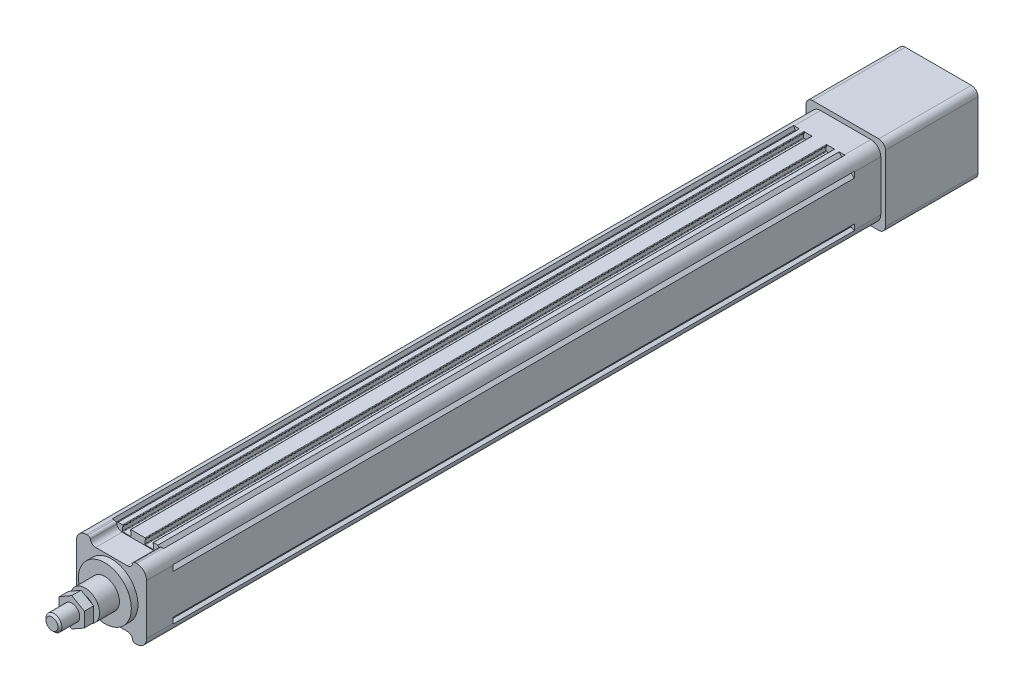
from build123d import *

# Parameters (mm, degrees)
SKETCH_1_R             = 2.1
EXTRUDE_1_DEPTH        = 515
EXTRUDE_2_DEPTH        = 20
SKETCH_7_R             = 20
EXTRUDE_3_DEPTH        = 5
SKETCH_9_R             = 11
EXTRUDE_4_DEPTH        = 15
SKETCH_10_R            = 6
EXTRUDE_5_DEPTH        = 25
EXTRUDE_START          = 20
EXTRUDE_6_DEPTH        = 20
EXTRUDE_7_DEPTH        = 70
SKETCH_14_R            = 19
CUT_EXTRUDE_2_DEPTH    = 70
HOLE_WIZARD_M6_1_D     = 5
HOLE_WIZARD_M6_1_DEPTH = 15
HOLE_WIZARD_M6_1_TIP   = 1.502151548
CHAMFER_1_SIZE         = 1.5
EXTRUDE_START_2        = 3
EXTRUDE_8_DEPTH        = 7


with BuildPart() as part:
    # 草图1 → 凸台-拉伸1 (new body)
    with BuildSketch(Plane.XY):
        with BuildLine():
            Line((-18.2, 24), (-19.443439638, 26.486879276))
            ThreePointArc((-19.443439638, 26.486879276), (-24.303300859, 24.303300859), (-26.486879276, 19.443439638))
            Line((-26.486879276, 19.443439638), (-24, 18.2))
            Line((-24, 18.2), (-24, 17.1))
            Line((-24, 17.1), (-26.5, 15))
            Line((-26.5, 15), (-26.5, -15))
            Line((-26.5, -15), (-24, -17.1))
            Line((-24, -17.1), (-24, -18.2))
            Line((-24, -18.2), (-26.486879276, -19.443439638))
            ThreePointArc((-26.486879276, -19.443439638), (-24.303300859, -24.303300859), (-19.443439638, -26.486879276))
            Line((-19.443439638, -26.486879276), (-18.2, -24))
            Line((-18.2, -24), (-17.1, -24))
            Line((-17.1, -24), (-15, -26.5))
            Line((-15, -26.5), (-11.65, -26.5))
            ThreePointArc((-11.65, -26.5), (-11.367157288, -26.382842712), (-11.25, -26.1))
            Line((-11.25, -26.1), (-11.25, -25.6))
            ThreePointArc((-11.25, -25.6), (-11.367157288, -25.317157288), (-11.65, -25.2))
            Line((-11.65, -25.2), (-11.75, -25.2))
            Line((-11.75, -25.2), (-11.75, -22.4))
            ThreePointArc((-11.75, -22.4), (-11.632842712, -22.117157288), (-11.35, -22))
            Line((-11.35, -22), (-5.65, -22))
            ThreePointArc((-5.65, -22), (-5.367157288, -22.117157288), (-5.25, -22.4))
            Line((-5.25, -22.4), (-5.25, -25.2))
            Line((-5.25, -25.2), (-5.35, -25.2))
            ThreePointArc((-5.35, -25.2), (-5.632842712, -25.317157288), (-5.75, -25.6))
            Line((-5.75, -25.6), (-5.75, -26.1))
            ThreePointArc((-5.75, -26.1), (-5.632842712, -26.382842712), (-5.35, -26.5))
            Line((-5.35, -26.5), (5.35, -26.5))
            ThreePointArc((5.35, -26.5), (5.632842712, -26.382842712), (5.75, -26.1))
            Line((5.75, -26.1), (5.75, -25.6))
            ThreePointArc((5.75, -25.6), (5.632842712, -25.317157288), (5.35, -25.2))
            Line((5.35, -25.2), (5.25, -25.2))
            Line((5.25, -25.2), (5.25, -22.4))
            ThreePointArc((5.25, -22.4), (5.367157288, -22.117157288), (5.65, -22))
            Line((5.65, -22), (11.35, -22))
            ThreePointArc((11.35, -22), (11.632842712, -22.117157288), (11.75, -22.4))
            Line((11.75, -22.4), (11.75, -25.2))
            Line((11.75, -25.2), (11.65, -25.2))
            ThreePointArc((11.65, -25.2), (11.367157288, -25.317157288), (11.25, -25.6))
            Line((11.25, -25.6), (11.25, -26.1))
            ThreePointArc((11.25, -26.1), (11.367157288, -26.382842712), (11.65, -26.5))
            Line((11.65, -26.5), (15, -26.5))
            Line((15, -26.5), (17.1, -24))
            Line((17.1, -24), (18.2, -24))
            Line((18.2, -24), (19.443439638, -26.486879276))
            ThreePointArc((19.443439638, -26.486879276), (24.303300859, -24.303300859), (26.486879276, -19.443439638))
            Line((26.486879276, -19.443439638), (24, -18.2))
            Line((24, -18.2), (24, -17.1))
            Line((24, -17.1), (26.5, -15))
            Line((26.5, -15), (26.5, 15))
            Line((26.5, 15), (24, 17.1))
            Line((24, 17.1), (24, 18.2))
            Line((24, 18.2), (26.486879276, 19.443439638))
            ThreePointArc((26.486879276, 19.443439638), (24.303300859, 24.303300859), (19.443439638, 26.486879276))
            Line((19.443439638, 26.486879276), (18.2, 24))
            Line((18.2, 24), (17.1, 24))
            Line((17.1, 24), (15, 26.5))
            Line((15, 26.5), (11.65, 26.5))
            ThreePointArc((11.65, 26.5), (11.367157288, 26.382842712), (11.25, 26.1))
            Line((11.25, 26.1), (11.25, 25.6))
            ThreePointArc((11.25, 25.6), (11.367157288, 25.317157288), (11.65, 25.2))
            Line((11.65, 25.2), (11.75, 25.2))
            Line((11.75, 25.2), (11.75, 22.4))
            ThreePointArc((11.75, 22.4), (11.632842712, 22.117157288), (11.35, 22))
            Line((11.35, 22), (5.65, 22))
            ThreePointArc((5.65, 22), (5.367157288, 22.117157288), (5.25, 22.4))
            Line((5.25, 22.4), (5.25, 25.2))
            Line((5.25, 25.2), (5.35, 25.2))
            ThreePointArc((5.35, 25.2), (5.632842712, 25.317157288), (5.75, 25.6))
            Line((5.75, 25.6), (5.75, 26.1))
            ThreePointArc((5.75, 26.1), (5.632842712, 26.382842712), (5.35, 26.5))
            Line((5.35, 26.5), (-5.35, 26.5))
            ThreePointArc((-5.35, 26.5), (-5.632842712, 26.382842712), (-5.75, 26.1))
            Line((-5.75, 26.1), (-5.75, 25.6))
            ThreePointArc((-5.75, 25.6), (-5.632842712, 25.317157288), (-5.35, 25.2))
            Line((-5.35, 25.2), (-5.25, 25.2))
            Line((-5.25, 25.2), (-5.25, 22.4))
            ThreePointArc((-5.25, 22.4), (-5.367157288, 22.117157288), (-5.65, 22))
            Line((-5.65, 22), (-11.35, 22))
            ThreePointArc((-11.35, 22), (-11.632842712, 22.117157288), (-11.75, 22.4))
            Line((-11.75, 22.4), (-11.75, 25.2))
            Line((-11.75, 25.2), (-11.65, 25.2))
            ThreePointArc((-11.65, 25.2), (-11.367157288, 25.317157288), (-11.25, 25.6))
            Line((-11.25, 25.6), (-11.25, 26.1))
            ThreePointArc((-11.25, 26.1), (-11.367157288, 26.382842712), (-11.65, 26.5))
            Line((-11.65, 26.5), (-15, 26.5))
            Line((-15, 26.5), (-17.1, 24))
            Line((-17.1, 24), (-18.2, 24))
        make_face()
        with Locations((19, 19)):
            Circle(SKETCH_1_R, mode=Mode.SUBTRACT)
        with Locations((19, -19)):
            Circle(SKETCH_1_R, mode=Mode.SUBTRACT)
        with Locations((-19, -19)):
            Circle(SKETCH_1_R, mode=Mode.SUBTRACT)
        with Locations((-19, 19)):
            Circle(SKETCH_1_R, mode=Mode.SUBTRACT)
        with BuildLine():
            Line((19.773719933, 3), (23.3, 3))
            Line((23.3, 3), (23.3, -3))
            Line((23.3, -3), (19.773719933, -3))
            ThreePointArc((19.773719933, -3), (0, -20), (-19.773719933, -3))
            Line((-19.773719933, -3), (-23.3, -3))
            Line((-23.3, -3), (-23.3, 3))
            Line((-23.3, 3), (-19.773719933, 3))
            ThreePointArc((-19.773719933, 3), (0, 20), (19.773719933, 3))
        make_face(mode=Mode.SUBTRACT)
    extrude(amount=EXTRUDE_1_DEPTH)

    # 草图6 → 凸台-拉伸2 (add)
    with BuildSketch(Plane.XY.offset(515)):
        with BuildLine():
            Line((-26.5, -19), (-26.5, 19))
            ThreePointArc((-26.5, 19), (-24.303300859, 24.303300859), (-19, 26.5))
            Line((-19, 26.5), (-17.916079783, 26.5))
            ThreePointArc((-17.916079783, 26.5), (-16.625085334, 26.027525232), (-15.944053189, 24.833333333))
            ThreePointArc((-15.944053189, 24.833333333), (-14.581988897, 22.444949537), (-12, 21.5))
            Line((-12, 21.5), (12, 21.5))
            ThreePointArc((12, 21.5), (14.581988897, 22.444949537), (15.944053189, 24.833333333))
            ThreePointArc((15.944053189, 24.833333333), (16.625085334, 26.027525232), (17.916079783, 26.5))
            Line((17.916079783, 26.5), (19, 26.5))
            ThreePointArc((19, 26.5), (24.303300859, 24.303300859), (26.5, 19))
            Line((26.5, 19), (26.5, -19))
            ThreePointArc((26.5, -19), (24.303300859, -24.303300859), (19, -26.5))
            Line((19, -26.5), (17.916079783, -26.5))
            ThreePointArc((17.916079783, -26.5), (16.625085334, -26.027525232), (15.944053189, -24.833333333))
            ThreePointArc((15.944053189, -24.833333333), (14.581988897, -22.444949537), (12, -21.5))
            Line((12, -21.5), (-12, -21.5))
            ThreePointArc((-12, -21.5), (-14.581988897, -22.444949537), (-15.944053189, -24.833333333))
            ThreePointArc((-15.944053189, -24.833333333), (-16.625085334, -26.027525232), (-17.916079783, -26.5))
            Line((-17.916079783, -26.5), (-19, -26.5))
            ThreePointArc((-19, -26.5), (-24.303300859, -24.303300859), (-26.5, -19))
        make_face()
    extrude(amount=EXTRUDE_2_DEPTH)

    # 草图7 → 凸台-拉伸3 (add)
    with BuildSketch(Plane.XY.offset(535)):
        Circle(SKETCH_7_R)
    extrude(amount=EXTRUDE_3_DEPTH)

    # 草图9 → 凸台-拉伸4 (add)
    with BuildSketch(Plane.XY.offset(540)):
        Circle(SKETCH_9_R)
    extrude(amount=EXTRUDE_4_DEPTH)

    # 草图10 → 凸台-拉伸5 (add)
    with BuildSketch(Plane.XY.offset(555)):
        Circle(SKETCH_10_R)
    extrude(amount=EXTRUDE_5_DEPTH)

    # 草图11 → 凸台-拉伸6 (add)
    with BuildSketch(Plane(origin=(0, 0, 0), x_dir=(-1, 0, 0), z_dir=(0, 0, -1)).offset(EXTRUDE_START)):
        with BuildLine():
            Line((-19, -26.5), (19, -26.5))
            ThreePointArc((19, -26.5), (24.303300859, -24.303300859), (26.5, -19))
            Line((26.5, -19), (26.5, 19))
            ThreePointArc((26.5, 19), (24.303300859, 24.303300859), (19, 26.5))
            Line((19, 26.5), (-19, 26.5))
            ThreePointArc((-19, 26.5), (-24.303300859, 24.303300859), (-26.5, 19))
            Line((-26.5, 19), (-26.5, -19))
            ThreePointArc((-26.5, -19), (-24.303300859, -24.303300859), (-19, -26.5))
        make_face()
    extrude(amount=-EXTRUDE_6_DEPTH)

    # 草图12 → 凸台-拉伸7 (add)
    with BuildSketch(Plane(origin=(0, 0, -20), x_dir=(-1, 0, 0), z_dir=(0, 0, -1))):
        with BuildLine():
            Line((-25, -30), (25, -30))
            ThreePointArc((25, -30), (28.535533906, -28.535533906), (30, -25))
            Line((30, -25), (30, 25))
            ThreePointArc((30, 25), (28.535533906, 28.535533906), (25, 30))
            Line((25, 30), (-25, 30))
            ThreePointArc((-25, 30), (-28.535533906, 28.535533906), (-30, 25))
            Line((-30, 25), (-30, -25))
            ThreePointArc((-30, -25), (-28.535533906, -28.535533906), (-25, -30))
        make_face()
    extrude(amount=EXTRUDE_7_DEPTH)

    # 草图14 → 切除-拉伸2 (cut)
    with BuildSketch(Plane(origin=(0, 0, -90), x_dir=(-1, 0, 0), z_dir=(0, 0, -1))):
        Circle(SKETCH_14_R)
    extrude(amount=-CUT_EXTRUDE_2_DEPTH, mode=Mode.SUBTRACT)

    # M6 螺纹孔1
    with Locations(Plane.ZY.offset(26.5)):
        with Locations((525, 11), (525, -11), (-10, 11), (-10, -11)):
            Hole(HOLE_WIZARD_M6_1_D / 2, depth=HOLE_WIZARD_M6_1_DEPTH)
            with Locations((0, 0, -(HOLE_WIZARD_M6_1_DEPTH + HOLE_WIZARD_M6_1_TIP / 2))):  # 118° drill point
                Cone(0, HOLE_WIZARD_M6_1_D / 2, HOLE_WIZARD_M6_1_TIP, mode=Mode.SUBTRACT)

    # 倒角1
    chamfer_1_edges = [part.edges().sort_by_distance(p)[0] for p in [
        (-6, 0, 580),
    ]]
    chamfer(chamfer_1_edges, length=CHAMFER_1_SIZE)

    # 草图17 → 凸台-拉伸8 (add)
    with BuildSketch(Plane.XY.offset(555).offset(EXTRUDE_START_2)):
        Polygon((0, 10.969655115), (-9.5, 5.484827557), (-9.5, -5.484827557), (0, -10.969655115), (9.5, -5.484827557), (9.5, 5.484827557), align=None)
    extrude(amount=EXTRUDE_8_DEPTH)


solid = part.part
